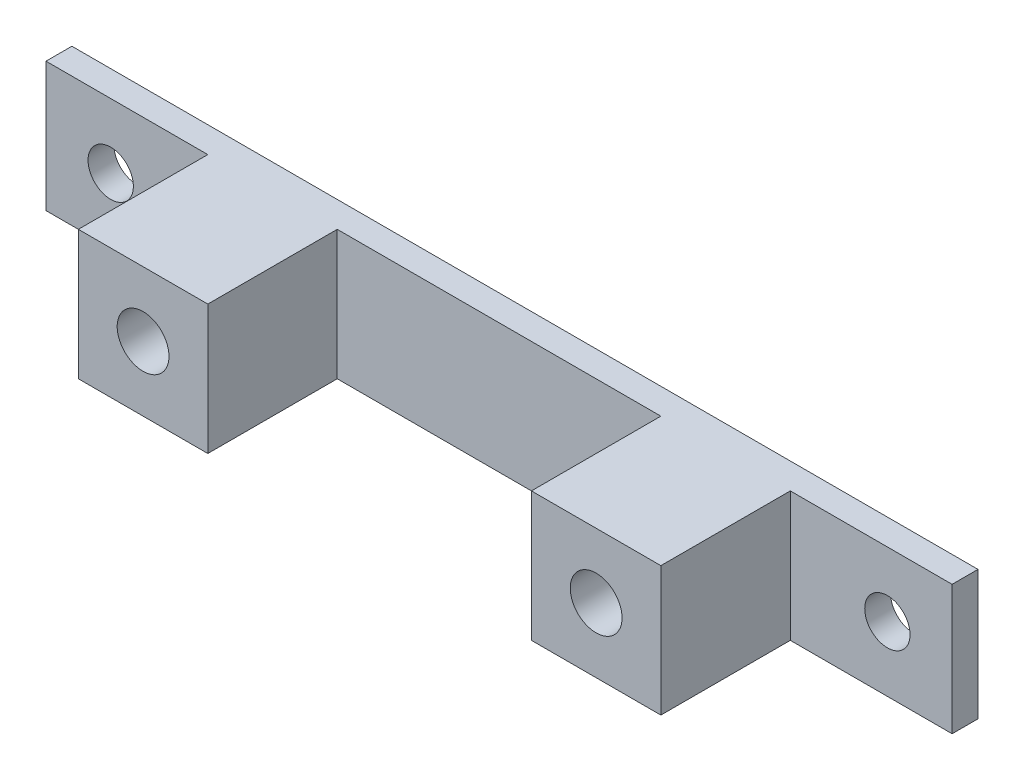
from build123d import *

# Parameters (mm, degrees)
ESQUISSE2_W             = 70
ESQUISSE2_H             = 10
BOSS_EXTRU_1_DEPTH      = 2
ESQUISSE3_W             = 10
ESQUISSE3_H             = 10
BOSS_EXTRU_2_DEPTH      = 10
ESQUISSE4_R             = 2
ESQUISSE4_R_2           = 1.75
ENL_V_MAT_EXTRU_1_DEPTH = 20


with BuildPart() as part:
    # Esquisse2 → Boss.-Extru.1 (new body)
    with BuildSketch(Plane.XY):
        with Locations((35, 5)):
            Rectangle(ESQUISSE2_W, ESQUISSE2_H)
    extrude(amount=BOSS_EXTRU_1_DEPTH)

    # Esquisse3 → Boss.-Extru.2 (add)
    with BuildSketch(Plane.XY.offset(2)):
        with Locations((17.5, 5)):
            Rectangle(ESQUISSE3_W, ESQUISSE3_H)
        with Locations((52.5, 5)):
            Rectangle(ESQUISSE3_W, ESQUISSE3_H)
    extrude(amount=BOSS_EXTRU_2_DEPTH)

    # Esquisse4 → Enlèv. mat.-Extru.1 (cut)
    with BuildSketch(Plane.XY.offset(12)):
        with Locations((52.5, 5)):
            Circle(ESQUISSE4_R)
        with Locations((17.5, 5)):
            Circle(ESQUISSE4_R)
        with Locations(Location((5, 5, 0), (0, 0, 180))):
            Circle(ESQUISSE4_R_2)
        with Locations(Location((65, 5, 0), (0, 0, 180))):
            Circle(ESQUISSE4_R_2)
    extrude(amount=-ENL_V_MAT_EXTRU_1_DEPTH, mode=Mode.SUBTRACT)


solid = part.part
